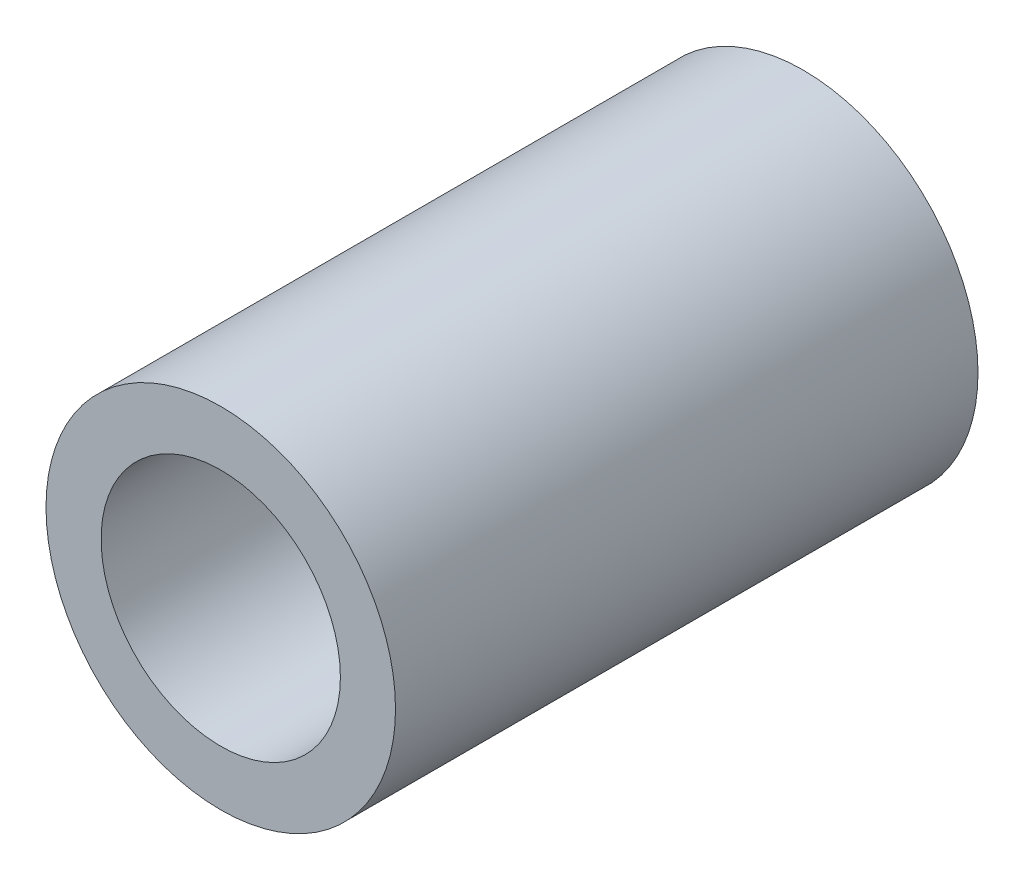
from build123d import *

# Parameters (mm, degrees)
SKETCH1_R           = 7.5
SKETCH1_R_2         = 5.135
BOSS_EXTRUDE1_DEPTH = 25


with BuildPart() as part:
    # Sketch1 → Boss-Extrude1 (new body)
    with BuildSketch(Plane.XY):
        Circle(SKETCH1_R)
        Circle(SKETCH1_R_2, mode=Mode.SUBTRACT)
    extrude(amount=BOSS_EXTRUDE1_DEPTH)


solid = part.part
